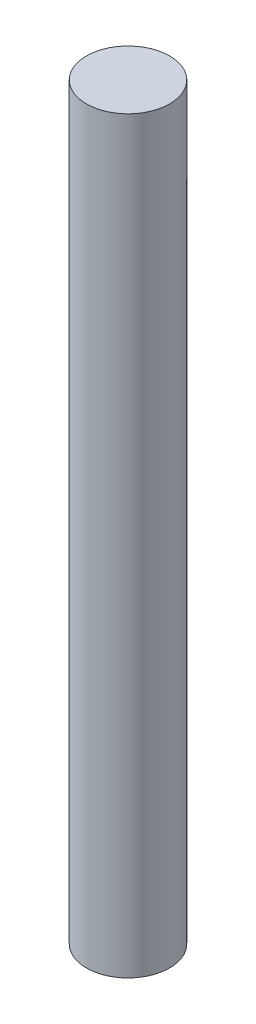
from build123d import *

# Parameters (mm, degrees)
SKETCH1_R           = 5
BOSS_EXTRUDE1_DEPTH = 90


with BuildPart() as part:
    # Sketch1 → Boss-Extrude1 (new body)
    with BuildSketch(Plane(origin=(0, 0, 0), x_dir=(1, 0, 0), z_dir=(0, 1, 0))):
        with Locations(Location((0, 0, 0), (0, 0, 90))):
            Circle(SKETCH1_R)
    extrude(amount=BOSS_EXTRUDE1_DEPTH)


solid = part.part
